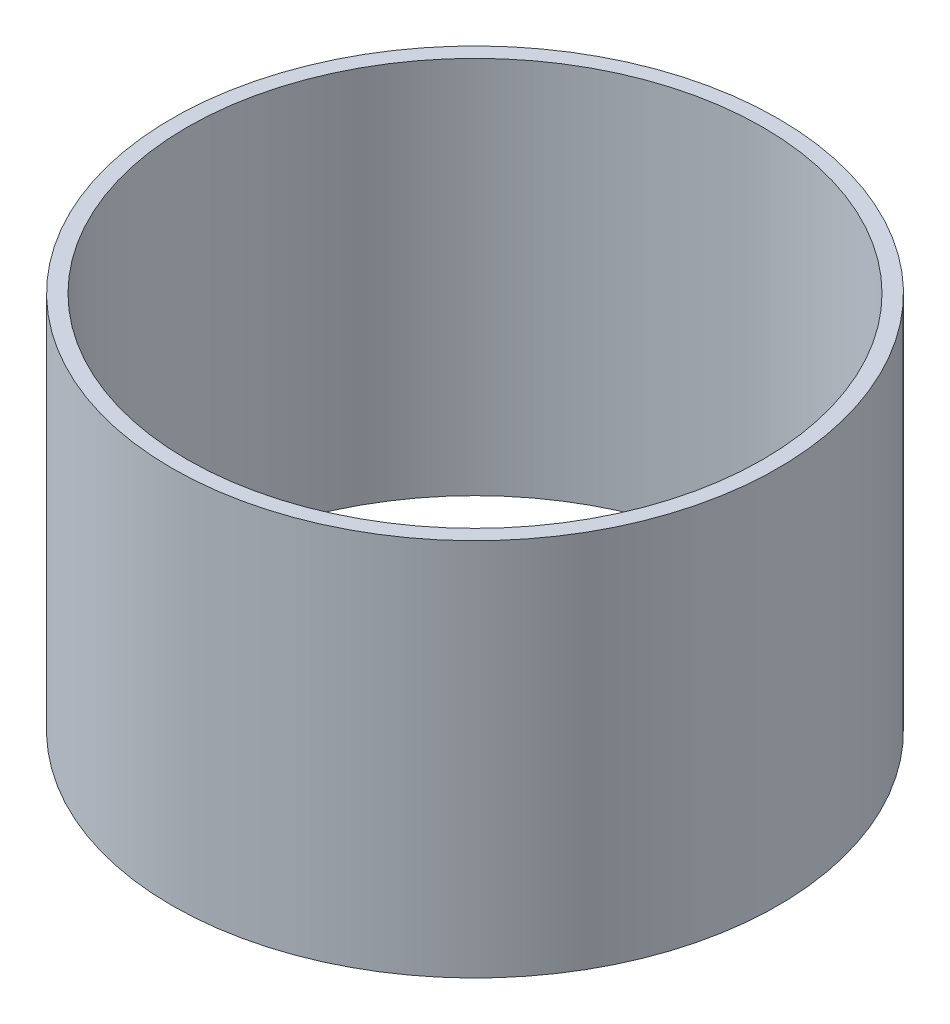
from build123d import *

# Parameters (mm, degrees)
SKETCH1_R           = 40
SKETCH1_R_2         = 38
BOSS_EXTRUDE1_DEPTH = 50


with BuildPart() as part:
    # Sketch1 → Boss-Extrude1 (new body)
    with BuildSketch(Plane(origin=(0, 0, 0), x_dir=(1, 0, 0), z_dir=(0, 1, 0))):
        with Locations(Location((0, 0, 0), (0, 0, 270))):
            Circle(SKETCH1_R)
        with Locations(Location((0, 0, 0), (0, 0, 270))):
            Circle(SKETCH1_R_2, mode=Mode.SUBTRACT)
    extrude(amount=BOSS_EXTRUDE1_DEPTH)


solid = part.part
